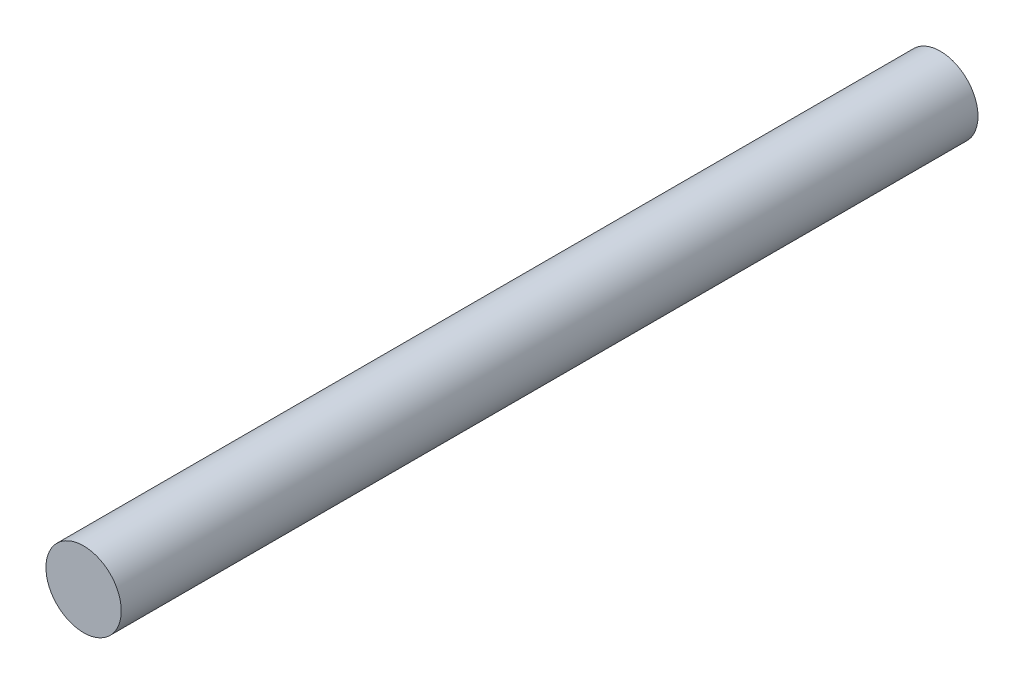
from build123d import *

# Parameters (mm, degrees)
SKETCH1_R           = 0.8
BOSS_EXTRUDE1_DEPTH = 18.2


with BuildPart() as part:
    # Sketch1 → Boss-Extrude1 (new body)
    with BuildSketch(Plane.XY):
        Circle(SKETCH1_R)
    extrude(amount=BOSS_EXTRUDE1_DEPTH)


solid = part.part
